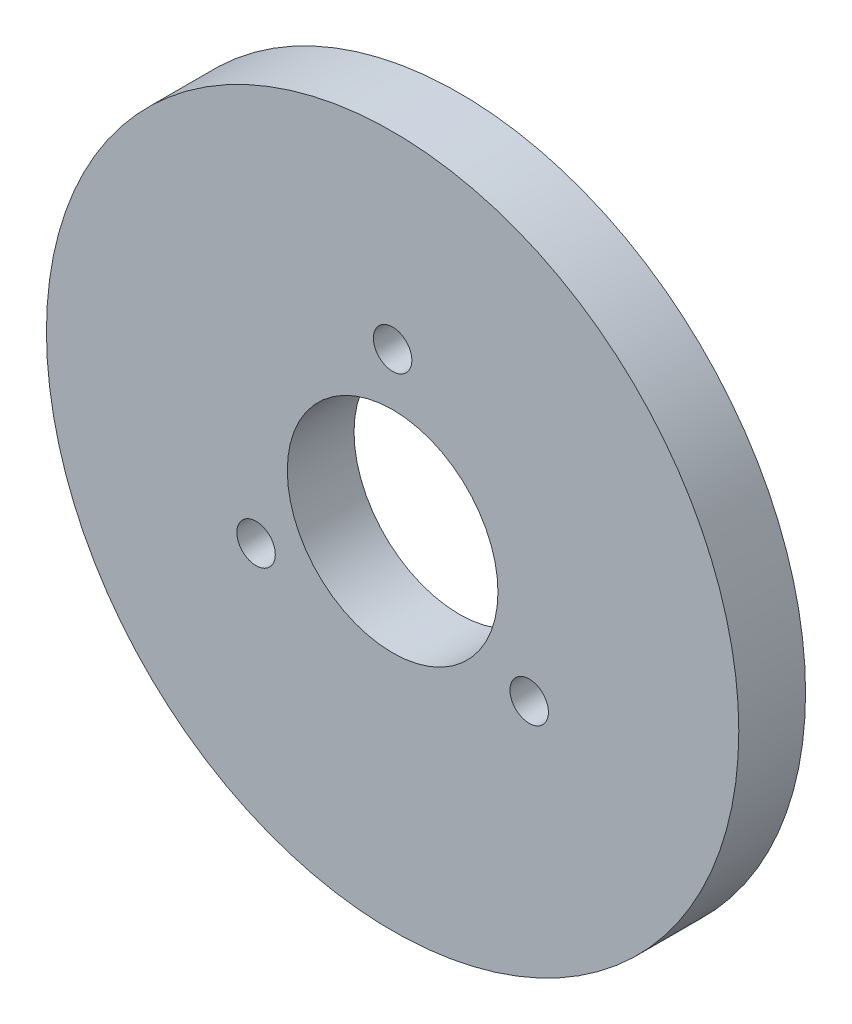
from build123d import *

# Parameters (mm, degrees)
SKETCH1_R           = 32.9311
SKETCH1_R_2         = 10.0203
SKETCH1_R_3         = 1.8288
BOSS_EXTRUDE1_DEPTH = 6.35


with BuildPart() as part:
    # Sketch1 → Boss-Extrude1 (new body)
    with BuildSketch(Plane.XY):
        Circle(SKETCH1_R)
        Circle(SKETCH1_R_2, mode=Mode.SUBTRACT)
        with Locations((0, 15)):
            Circle(SKETCH1_R_3, mode=Mode.SUBTRACT)
        with Locations((12.990381057, -7.5)):
            Circle(SKETCH1_R_3, mode=Mode.SUBTRACT)
        with Locations((-12.990381057, -7.5)):
            Circle(SKETCH1_R_3, mode=Mode.SUBTRACT)
    extrude(amount=BOSS_EXTRUDE1_DEPTH)


solid = part.part
